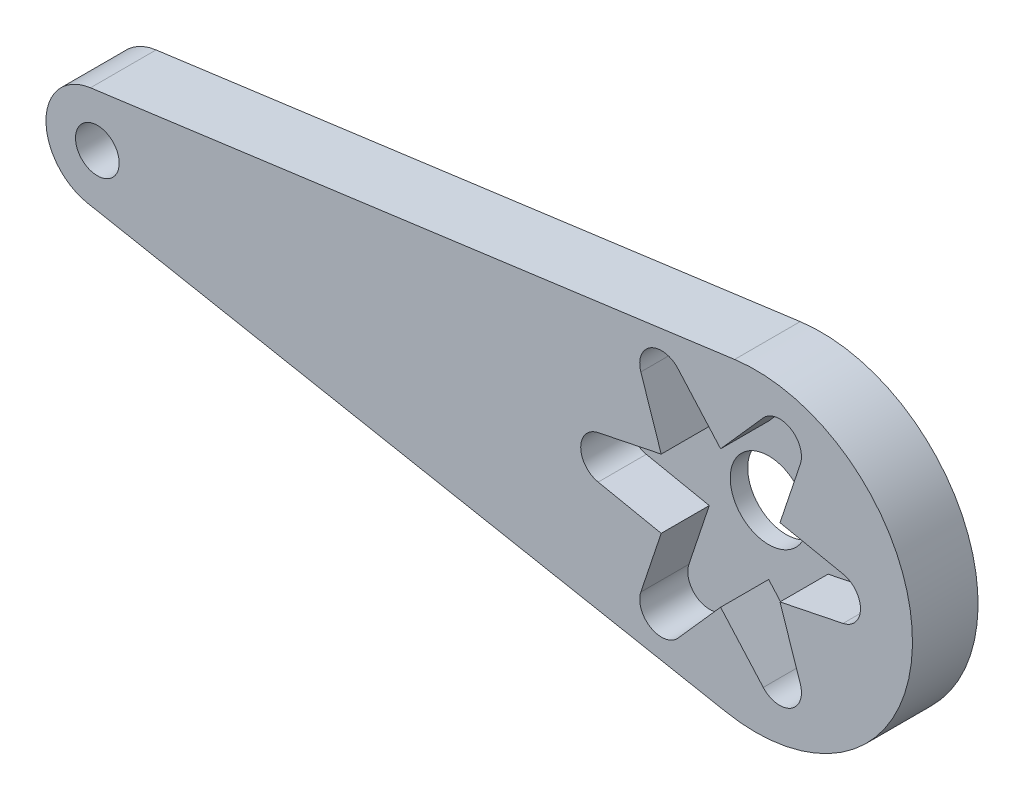
from build123d import *

# Parameters (mm, degrees)
BOSS_EXTRUDE4_DEPTH = 7.5
FILLET2_R           = 17.944929
FILLET3_R           = 5.875428
CUT_EXTRUDE6_DEPTH  = 5.5
SKETCH9_R           = 4.4
CUT_EXTRUDE8_DEPTH  = 29
SKETCH10_R          = 2.5
CUT_EXTRUDE9_DEPTH  = 29


with BuildPart() as part:
    # Sketch1 → Boss-Extrude4 (new body)
    with BuildSketch(Plane.XY):
        Polygon((0, -30.610295464), (0, -40.610295464), (99.104144123, -59.46005289), (99.104144123, -17.254824013), align=None)
    extrude(amount=BOSS_EXTRUDE4_DEPTH)

    # Fillet2
    fillet2_edges = [part.edges().sort_by_distance(p)[0] for p in [
        (99.104144123, -17.254824013, 3.75),
        (99.104144123, -59.46005289, 3.75),
    ]]
    fillet(fillet2_edges, radius=FILLET2_R)

    # Fillet3
    fillet3_edges = [part.edges().sort_by_distance(p)[0] for p in [
        (0, -40.610295464, 3.75),
        (0, -30.610295464, 3.75),
    ]]
    fillet(fillet3_edges, radius=FILLET3_R)

    # Sketch7 → Cut-Extrude6 (cut)
    with BuildSketch(Plane.XY.offset(7.5)):
        with BuildLine():
            Line((70.363905336, -33.572647528), (68.036302236, -26.594866387))
            ThreePointArc((68.036302236, -26.594866387), (69.157839534, -23.638720805), (72.278705354, -24.145513805))
            Line((72.278705354, -24.145513805), (77.157839534, -29.65016779))
            Line((77.157839534, -29.65016779), (82.036973713, -24.145513805))
            ThreePointArc((82.036973713, -24.145513805), (85.157839534, -23.638720805), (86.279376831, -26.594866387))
            Line((86.279376831, -26.594866387), (83.951773731, -33.572647528))
            Line((83.951773731, -33.572647528), (91.158511011, -35.045774684))
            ThreePointArc((91.158511011, -35.045774684), (93.157839534, -37.495127266), (91.158511011, -39.944479848))
            Line((91.158511011, -39.944479848), (83.951773731, -41.417607003))
            Line((83.951773731, -41.417607003), (86.279376831, -48.395388144))
            ThreePointArc((86.279376831, -48.395388144), (85.157839534, -51.351533726), (82.036973713, -50.844740726))
            Line((82.036973713, -50.844740726), (77.157839534, -45.340086741))
            Line((77.157839534, -45.340086741), (72.278705354, -50.844740726))
            ThreePointArc((72.278705354, -50.844740726), (69.157839534, -51.351533726), (68.036302236, -48.395388144))
            Line((68.036302236, -48.395388144), (70.363905336, -41.417607003))
            Line((70.363905336, -41.417607003), (63.157168056, -39.944479848))
            ThreePointArc((63.157168056, -39.944479848), (61.157839534, -37.495127266), (63.157168056, -35.045774684))
            Line((63.157168056, -35.045774684), (70.363905336, -33.572647528))
        make_face()
    extrude(amount=-CUT_EXTRUDE6_DEPTH, mode=Mode.SUBTRACT)

    # Sketch9 → Cut-Extrude8 (cut)
    with BuildSketch(Plane.XY.offset(7.5)):
        with Locations((77.157839534, -37.495127266)):
            Circle(SKETCH9_R)
    extrude(amount=-CUT_EXTRUDE8_DEPTH, mode=Mode.SUBTRACT)

    # Sketch10 → Cut-Extrude9 (cut)
    with BuildSketch(Plane.XY.offset(7.5)):
        with Locations((5.875428046, -35.747050315)):
            Circle(SKETCH10_R)
    extrude(amount=-CUT_EXTRUDE9_DEPTH, mode=Mode.SUBTRACT)


solid = part.part
